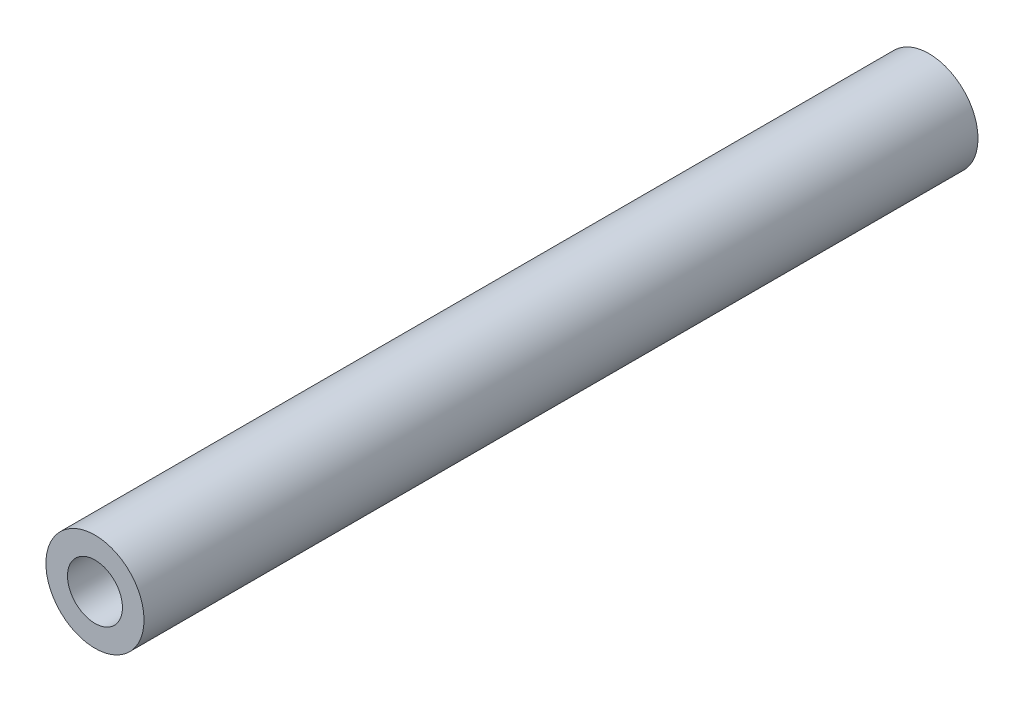
from build123d import *

# Parameters (mm, degrees)
SKETCH1_R           = 3.175
BOSS_EXTRUDE1_DEPTH = 53.975
SKETCH2_R           = 1.778
CUT_EXTRUDE1_DEPTH  = 53.975


with BuildPart() as part:
    # Sketch1 → Boss-Extrude1 (new body)
    with BuildSketch(Plane.XY):
        Circle(SKETCH1_R)
    extrude(amount=BOSS_EXTRUDE1_DEPTH)

    # Sketch2 → Cut-Extrude1 (cut)
    with BuildSketch(Plane.XY.offset(53.975)):
        Circle(SKETCH2_R)
    extrude(amount=-CUT_EXTRUDE1_DEPTH, mode=Mode.SUBTRACT)


solid = part.part
